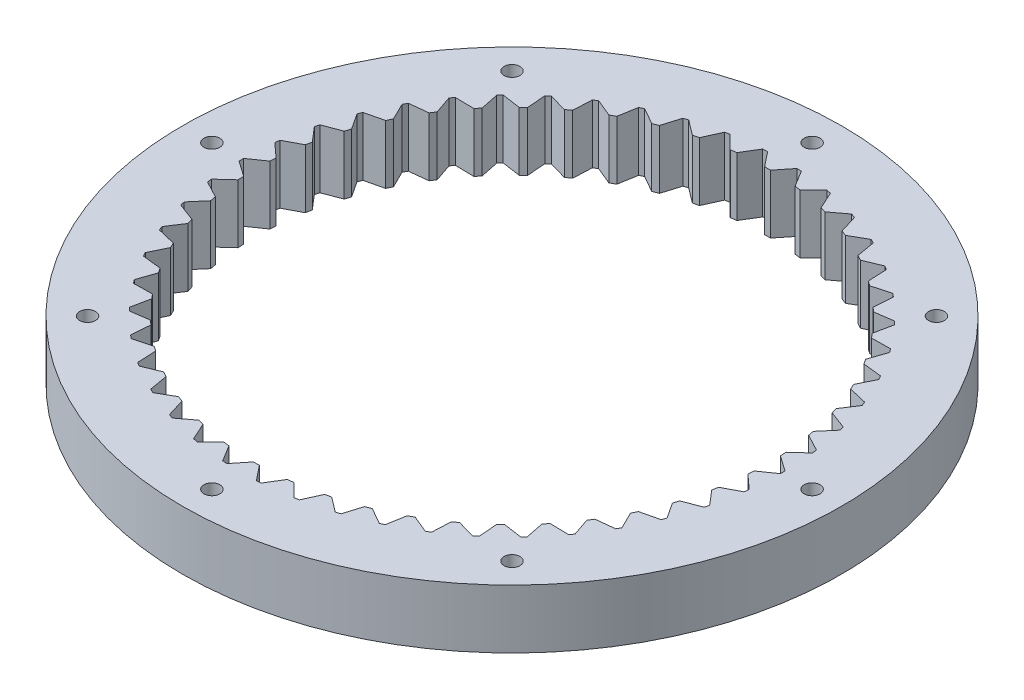
from build123d import *

# Parameters (mm, degrees)
SKETCH1_R          = 56
SKETCH1_R_2        = 46
MAINBODY_DEPTH     = 10
SINGLETOOTH_DEPTH  = 10
TOOTHPATTERN_COUNT = 50
SKETCH3_R          = 1.35
CUT_EXTRUDE1_DEPTH = 80.824808174


with BuildPart() as part:
    # Sketch1 → MainBody (new body)
    with BuildSketch(Plane(origin=(0, 0, 0), x_dir=(1, 0, 0), z_dir=(0, 1, 0))):
        with Locations(Location((0, 0, 0), (0, 0, 270))):
            Circle(SKETCH1_R)
        with Locations(Location((0, 0, 0), (0, 0, 270))):
            Circle(SKETCH1_R_2, mode=Mode.SUBTRACT)
    extrude(amount=MAINBODY_DEPTH)

    # Sketch2 → SingleTooth (add)
    with BuildSketch(Plane(origin=(0, 0, 0), x_dir=(1, 0, 0), z_dir=(0, 1, 0))):
        Polygon((0.5, 43.432014979), (-0.5, 43.432014979), (-2.5, 45.932014979), (2.5, 45.932014979), align=None)
        Polygon((-0.5, 48.432014979), (-2.5, 45.932014979), (2.5, 45.932014979), (0.5, 48.432014979), align=None)
    singletooth = extrude(amount=SINGLETOOTH_DEPTH)

    # ToothPattern: SingleTooth ×50 about axis
    toothpattern_axis = Axis((0, 0, 0), (0, 1, 0))
    for i in range(1, TOOTHPATTERN_COUNT):
        add(singletooth.rotate(toothpattern_axis, i * 360 / TOOTHPATTERN_COUNT))

    # Sketch3 → Cut-Extrude1 (cut, through all)
    with BuildSketch(Plane(origin=(0, 10, 0), x_dir=(1, 0, 0), z_dir=(0, 1, 0))):
        with Locations(Location((-51, 0, 0), (0, 0, 270))):
            Circle(SKETCH3_R)
        with Locations(Location((-36.062445841, 36.062445841, 0), (0, 0, 270))):
            Circle(SKETCH3_R)
        with Locations(Location((0, 51, 0), (0, 0, 270))):
            Circle(SKETCH3_R)
        with Locations(Location((36.062445841, 36.062445841, 0), (0, 0, 270))):
            Circle(SKETCH3_R)
        with Locations(Location((51, 0, 0), (0, 0, 270))):
            Circle(SKETCH3_R)
        with Locations(Location((36.062445841, -36.062445841, 0), (0, 0, 270))):
            Circle(SKETCH3_R)
        with Locations(Location((0, -51, 0), (0, 0, 270))):
            Circle(SKETCH3_R)
        with Locations(Location((-36.062445841, -36.062445841, 0), (0, 0, 270))):
            Circle(SKETCH3_R)
    extrude(amount=-CUT_EXTRUDE1_DEPTH, mode=Mode.SUBTRACT)


solid = part.part
